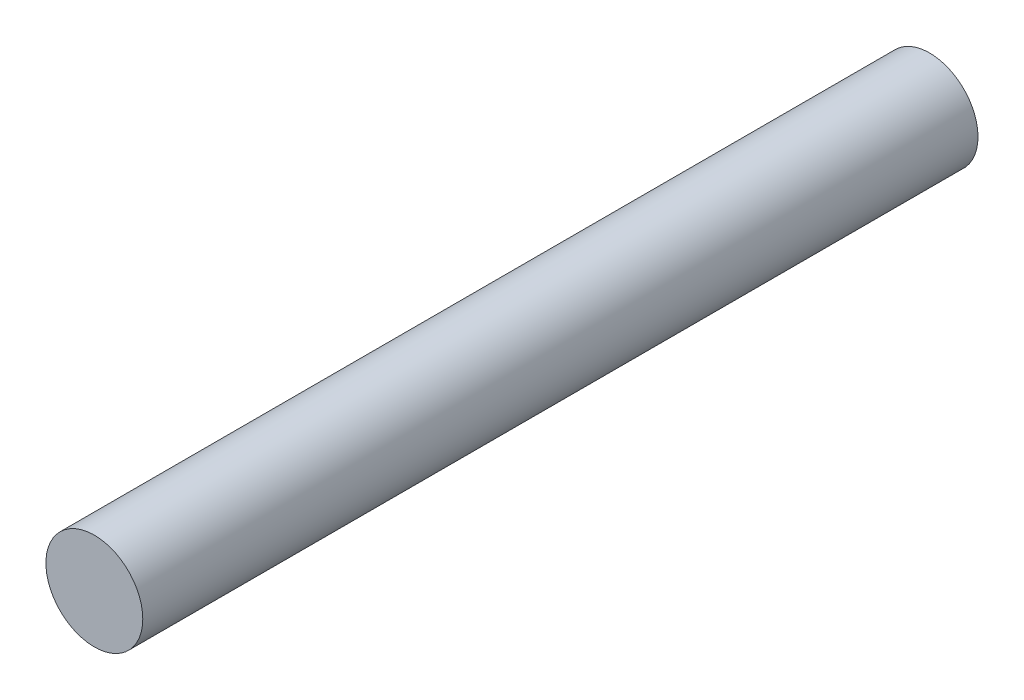
from build123d import *

# Parameters (mm, degrees)
SKETCH_1_R      = 10.729381299
EXTRUDE_1_DEPTH = 185


with BuildPart() as part:
    # Эскиз1 → Бобышка-Вытянуть1 (new body)
    with BuildSketch(Plane.XY):
        with Locations((-19.7286285, -1.859528572)):
            Circle(SKETCH_1_R)
    extrude(amount=EXTRUDE_1_DEPTH)


solid = part.part
